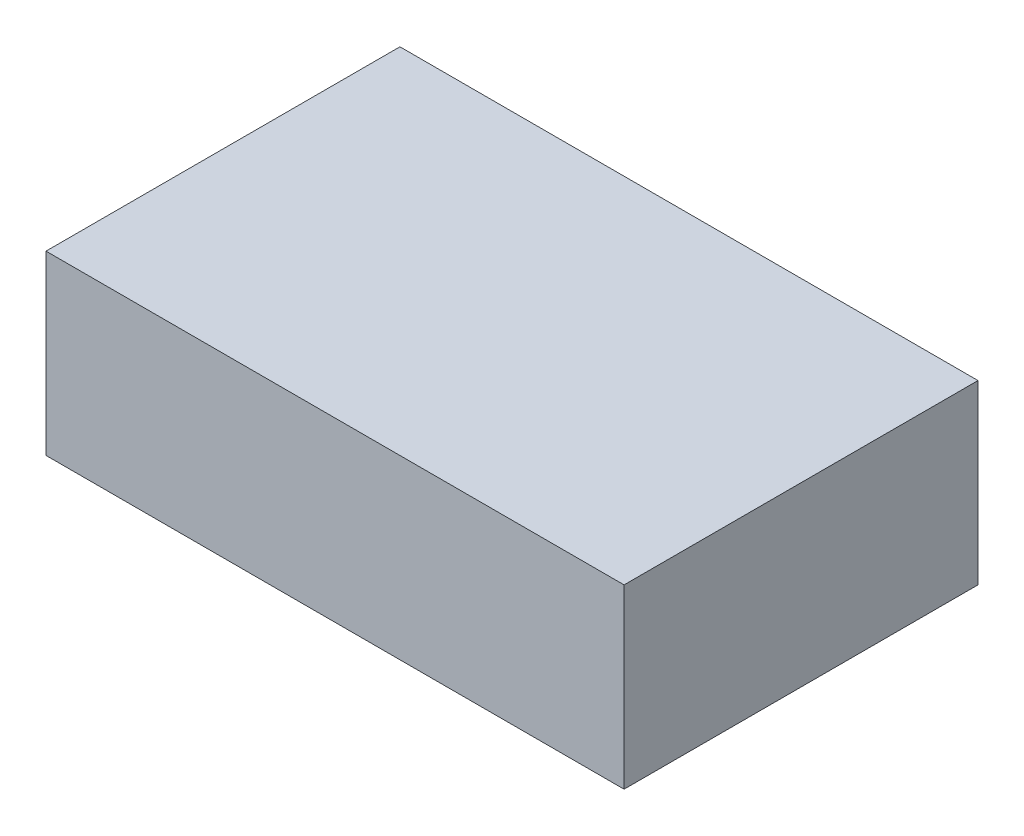
from build123d import *

# Parameters (mm, degrees)
SKETCH_1_W      = 98
SKETCH_1_H      = 60
EXTRUDE_1_DEPTH = 30


with BuildPart() as part:
    # 草图1 → 凸台-拉伸1 (new body)
    with BuildSketch(Plane(origin=(0, 0, 0), x_dir=(1, 0, 0), z_dir=(0, 1, 0))):
        Rectangle(SKETCH_1_W, SKETCH_1_H)
    extrude(amount=EXTRUDE_1_DEPTH)


solid = part.part
